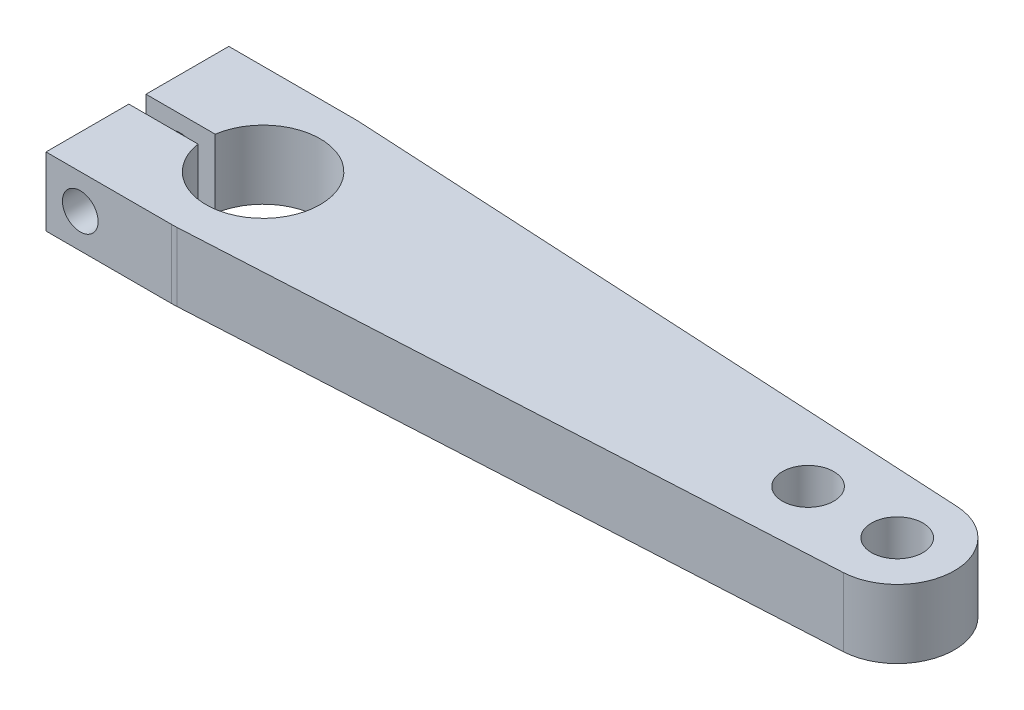
from build123d import *

# Parameters (mm, degrees)
CROQUIS1_R              = 10
SALIENTE_EXTRUIR1_DEPTH = 12
CROQUIS2_W              = 21.833325304
CROQUIS2_H              = 3
CORTAR_EXTRUIR1_DEPTH   = 12
CROQUIS3_R              = 3.125
CORTAR_EXTRUIR2_DEPTH   = 126.733845881
CORTAR_EXTRUIR3_REACH   = 124.642
CROQUIS6_R              = 4.5


with BuildPart() as part:
    # Croquis1 → Saliente-Extruir1 (new body)
    with BuildSketch(Plane(origin=(0, 0, 0), x_dir=(1, 0, 0), z_dir=(0, 1, 0))):
        with BuildLine():
            Line((0.864864865, 15.976608175), (111.540540541, 9.985380109))
            ThreePointArc((111.540540541, 9.985380109), (121, 0), (111.540540541, -9.985380109))
            Line((111.540540541, -9.985380109), (0.864864865, -15.976608175))
            ThreePointArc((0.864864865, -15.976608175), (0.432590572, -15.994150975), (0, -16))
            Line((0, -16), (-22, -16))
            Line((-22, -16), (-22, 16))
            Line((-22, 16), (0, 16))
            ThreePointArc((0, 16), (0.432590572, 15.994150975), (0.864864865, 15.976608175))
        make_face()
        with Locations(Location((0, 0, 0), (0, 0, 270))):
            Circle(CROQUIS1_R, mode=Mode.SUBTRACT)
    extrude(amount=SALIENTE_EXTRUIR1_DEPTH)

    # Croquis2 → Cortar-Extruir1 (cut)
    with BuildSketch(Plane(origin=(0, 12, 0), x_dir=(1, 0, 0), z_dir=(0, 1, 0))):
        with Locations((-17.033164983, 0)):
            Rectangle(CROQUIS2_W, CROQUIS2_H)
    extrude(amount=-CORTAR_EXTRUIR1_DEPTH, mode=Mode.SUBTRACT)

    # Croquis3 → Cortar-Extruir2 (cut, through all)
    with BuildSketch(Plane.XY.offset(16)):
        with Locations((-16, 6)):
            Circle(CROQUIS3_R)
    extrude(amount=-CORTAR_EXTRUIR2_DEPTH, mode=Mode.SUBTRACT)

    # Croquis6 → Cortar-Extruir3 (cut, up to next)
    with BuildSketch(Plane(origin=(0, 12, 0), x_dir=(1, 0, 0), z_dir=(0, 1, 0)), mode=Mode.PRIVATE) as cortar_extruir3_sk1:
        with Locations(Location((111, 0, 0), (0, 0, 270))):
            Circle(CROQUIS6_R)
    cortar_extruir3_tool1 = extrude(cortar_extruir3_sk1.sketch, amount=-CORTAR_EXTRUIR3_REACH, mode=Mode.PRIVATE) & part.part
    # Croquis6 → Cortar-Extruir3 (cut, up to next)
    with BuildSketch(Plane(origin=(0, 12, 0), x_dir=(1, 0, 0), z_dir=(0, 1, 0)), mode=Mode.PRIVATE) as cortar_extruir3_sk2:
        with Locations(Location((95.4, 0, 0), (0, 0, 270))):
            Circle(CROQUIS6_R)
    cortar_extruir3_tool2 = extrude(cortar_extruir3_sk2.sketch, amount=-CORTAR_EXTRUIR3_REACH, mode=Mode.PRIVATE) & part.part
    add(cortar_extruir3_tool1.solids().sort_by_distance((111, 12, 0))[0], mode=Mode.SUBTRACT)
    add(cortar_extruir3_tool2.solids().sort_by_distance((95.4, 12, 0))[0], mode=Mode.SUBTRACT)


solid = part.part
